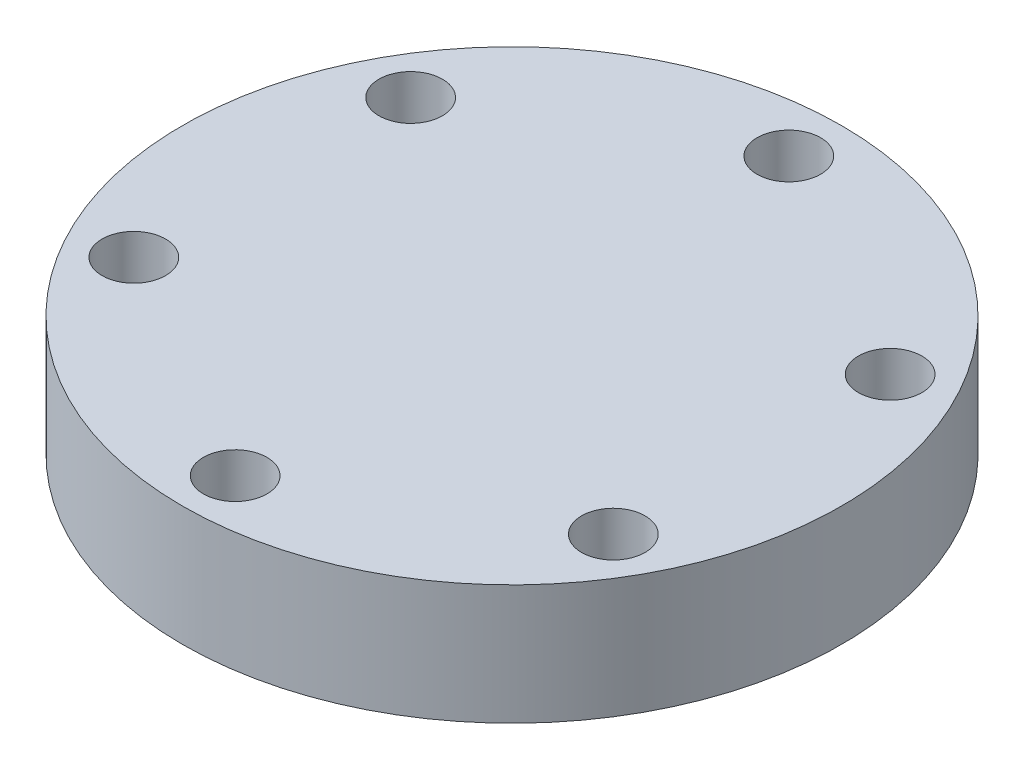
from build123d import *

# Parameters (mm, degrees)
SKETCH1_R          = 34.925
EXTRUDE1_DEPTH     = 12.7
SKETCH3_R          = 3.3655
CUT_EXTRUDE2_DEPTH = 12.7
CIRPATTERN1_COUNT  = 6


with BuildPart() as part:
    # Sketch1 → Extrude1 (new body)
    with BuildSketch(Plane(origin=(0, 0, 0), x_dir=(1, 0, 0), z_dir=(0, 1, 0))):
        Circle(SKETCH1_R)
    extrude(amount=EXTRUDE1_DEPTH)

    # Sketch3 → Cut-Extrude2 (cut)
    with BuildSketch(Plane(origin=(0, 0, 0), x_dir=(1, 0, 0), z_dir=(0, 1, 0))):
        with Locations((0, 29.337)):
            Circle(SKETCH3_R)
    cut_extrude2 = extrude(amount=CUT_EXTRUDE2_DEPTH, mode=Mode.SUBTRACT)

    # CirPattern1: Cut-Extrude2 ×6 about axis
    cirpattern1_axis = Axis((0, 35.858162691, 0), (0, -1, 0))
    for i in range(1, CIRPATTERN1_COUNT):
        add(cut_extrude2.rotate(cirpattern1_axis, i * 360 / CIRPATTERN1_COUNT), mode=Mode.SUBTRACT)


solid = part.part
